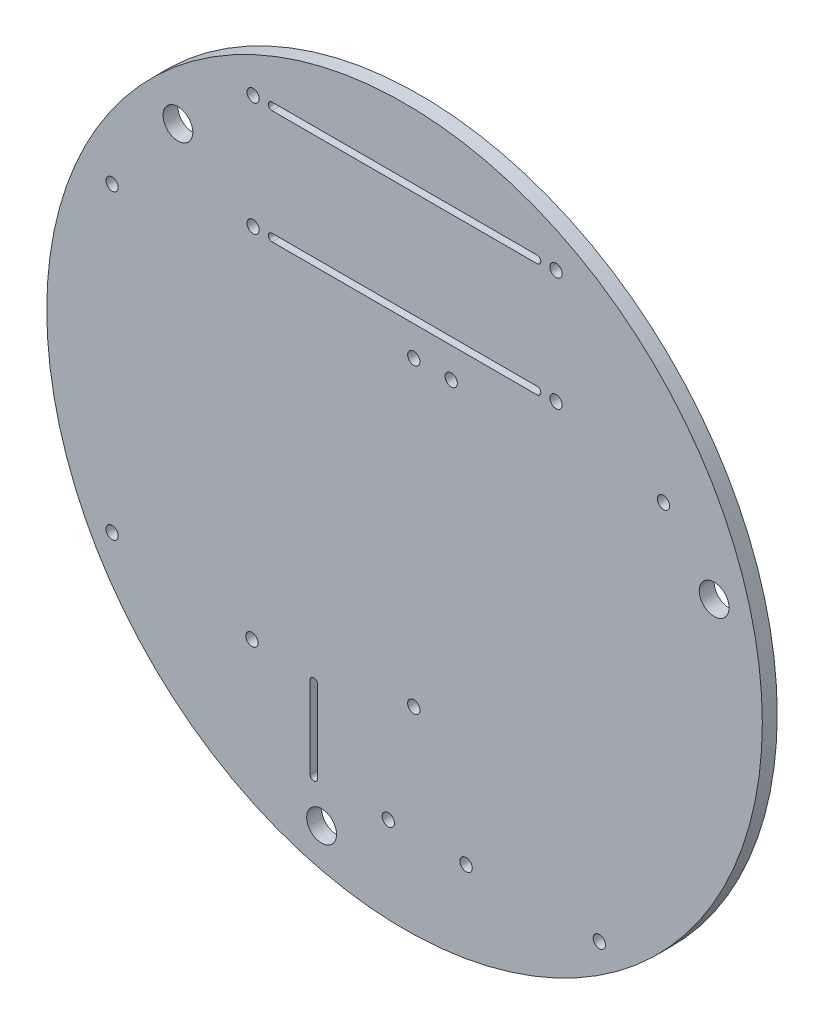
from build123d import *

# Parameters (mm, degrees)
SKETCH1_R                    = 48
BOSS_EXTRUDE1_DEPTH          = 2
SKETCH3_R                    = 2
CUT_EXTRUDE1_DEPTH           = 68.911707385
SKETCH2_R                    = 0.825
CUT_EXTRUDE_NANO_RECTO_DEPTH = 68.911707385
SKETCH4_R                    = 0.825
CUT_EXTRUDE_VERSO_DEPTH      = 68.911707385


with BuildPart() as part:
    # Sketch1 → Boss-Extrude1 (new body)
    with BuildSketch(Plane.XY):
        Circle(SKETCH1_R)
    extrude(amount=BOSS_EXTRUDE1_DEPTH)

    # Sketch3 → Cut-Extrude1 (cut, through all)
    with BuildSketch(Plane(origin=(0, 0, 0), x_dir=(-1, 0, 0), z_dir=(0, 0, -1))):
        with Locations((30.405591591, 30.405591591)):
            Circle(SKETCH3_R)
        with Locations((11.129218939, -41.53481053)):
            Circle(SKETCH3_R)
        with Locations((-41.53481053, 11.129218939)):
            Circle(SKETCH3_R)
    extrude(amount=-CUT_EXTRUDE1_DEPTH, mode=Mode.SUBTRACT)

    # Sketch2 → Cut-Extrude-Nano+Recto (cut, through all)
    with BuildSketch(Plane.XY.offset(2)):
        with Locations((20.32, 38.74)):
            Circle(SKETCH2_R)
        with Locations(Location((20.32, 23.5, 0), (0, 0, 180))):
            Circle(SKETCH2_R)
        with Locations((-20.32, 23.5)):
            Circle(SKETCH2_R)
        with Locations(Location((-20.32, 38.74, 0), (0, 0, 180))):
            Circle(SKETCH2_R)
        with Locations((34.74, 18.98)):
            Circle(SKETCH2_R)
        with Locations(Location((6.26, 18.98, 0), (0, 0, 180))):
            Circle(SKETCH2_R)
        with Locations((-39.24, 18.98)):
            Circle(SKETCH2_R)
        with Locations(Location((1.24, 18.98, 0), (0, 0, 180))):
            Circle(SKETCH2_R)
        with Locations((1.24, -21.5)):
            Circle(SKETCH2_R)
        with Locations(Location((-39.24, -21.5, 0), (0, 0, 180))):
            Circle(SKETCH2_R)
        with BuildLine():
            Line((17.78, 23), (-17.78, 23))
            ThreePointArc((-17.78, 23), (-18.28, 23.5), (-17.78, 24))
            Line((-17.78, 24), (17.78, 24))
            ThreePointArc((17.78, 24), (18.28, 23.5), (17.78, 23))
        make_face()
        with BuildLine():
            Line((17.78, 39.24), (-17.78, 39.24))
            ThreePointArc((-17.78, 39.24), (-18.28, 38.74), (-17.78, 38.24))
            Line((-17.78, 38.24), (17.78, 38.24))
            ThreePointArc((17.78, 38.24), (18.28, 38.74), (17.78, 39.24))
        make_face()
    extrude(amount=-CUT_EXTRUDE_NANO_RECTO_DEPTH, mode=Mode.SUBTRACT)

    # Sketch4 → Cut-Extrude-Verso (cut, through all)
    with BuildSketch(Plane(origin=(0, 0, 0), x_dir=(-1, 0, 0), z_dir=(0, 0, -1))):
        with Locations((-8.26, -36.34)):
            Circle(SKETCH4_R)
        with Locations((2.18, -36.34)):
            Circle(SKETCH4_R)
        with Locations(Location((-26.13, -36.34, 0), (0, 0, 180))):
            Circle(SKETCH4_R)
        with Locations((20.48, -24.54)):
            Circle(SKETCH4_R)
        with BuildLine():
            Line((11.68, -36.34), (11.68, -25.34))
            ThreePointArc((11.68, -25.34), (12.18, -24.84), (12.68, -25.34))
            Line((12.68, -25.34), (12.68, -36.34))
            ThreePointArc((12.68, -36.34), (12.18, -36.84), (11.68, -36.34))
        make_face()
    extrude(amount=-CUT_EXTRUDE_VERSO_DEPTH, mode=Mode.SUBTRACT)


solid = part.part
